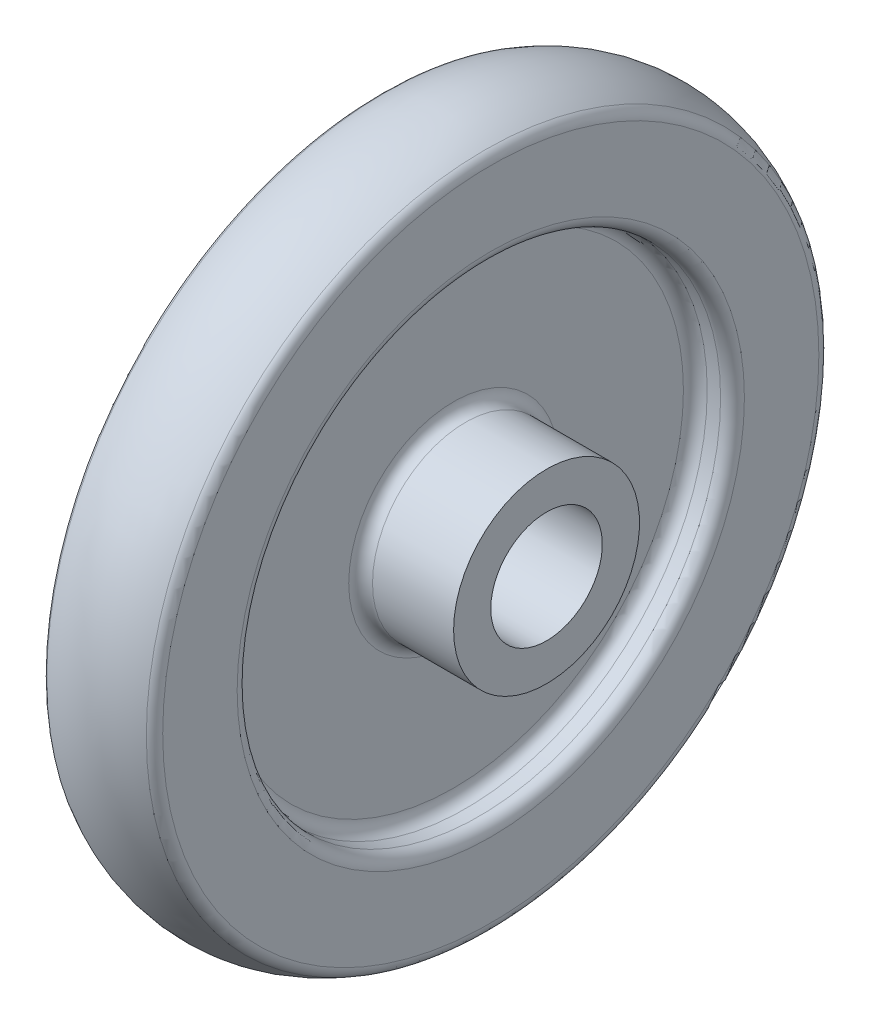
from build123d import *


with BuildPart() as part:
    # Sketch1 → Revolve1 (revolve)
    with BuildSketch(Plane.XY, mode=Mode.PRIVATE) as revolve1_sk:
        with BuildLine():
            Line((0, 9.525), (38.1, 9.525))
            Line((38.1, 9.525), (38.1, 15.875))
            Line((38.1, 15.875), (24.257, 15.875))
            ThreePointArc((24.257, 15.875), (22.820159021, 16.470159021), (22.225, 17.907))
            Line((22.225, 17.907), (22.225, 39.243))
            ThreePointArc((22.225, 39.243), (22.820159021, 40.679840979), (24.257, 41.275))
            Line((24.257, 41.275), (26.543, 41.275))
            ThreePointArc((26.543, 41.275), (27.979840979, 41.870159021), (28.575, 43.307))
            Line((28.575, 43.307), (28.575, 56.016390606))
            ThreePointArc((28.575, 56.016390606), (28.299320593, 57.038330904), (27.547084672, 57.782979967))
            ThreePointArc((27.547084672, 57.782979967), (19.05, 60.029022291), (10.552915328, 57.782979967))
            ThreePointArc((10.552915328, 57.782979967), (9.800679407, 57.038330904), (9.525, 56.016390606))
            Line((9.525, 56.016390606), (9.525, 43.307))
            ThreePointArc((9.525, 43.307), (10.120159021, 41.870159021), (11.557, 41.275))
            Line((11.557, 41.275), (13.843, 41.275))
            ThreePointArc((13.843, 41.275), (15.279840979, 40.679840979), (15.875, 39.243))
            Line((15.875, 39.243), (15.875, 17.907))
            ThreePointArc((15.875, 17.907), (15.279840979, 16.470159021), (13.843, 15.875))
            Line((13.843, 15.875), (0, 15.875))
            Line((0, 15.875), (0, 9.525))
        make_face()
    revolve(revolve1_sk.sketch.rotate(Axis((0, 0, 0), (1, 0, 0)), 90), axis=Axis((0, 0, 0), (1, 0, 0)))


solid = part.part
